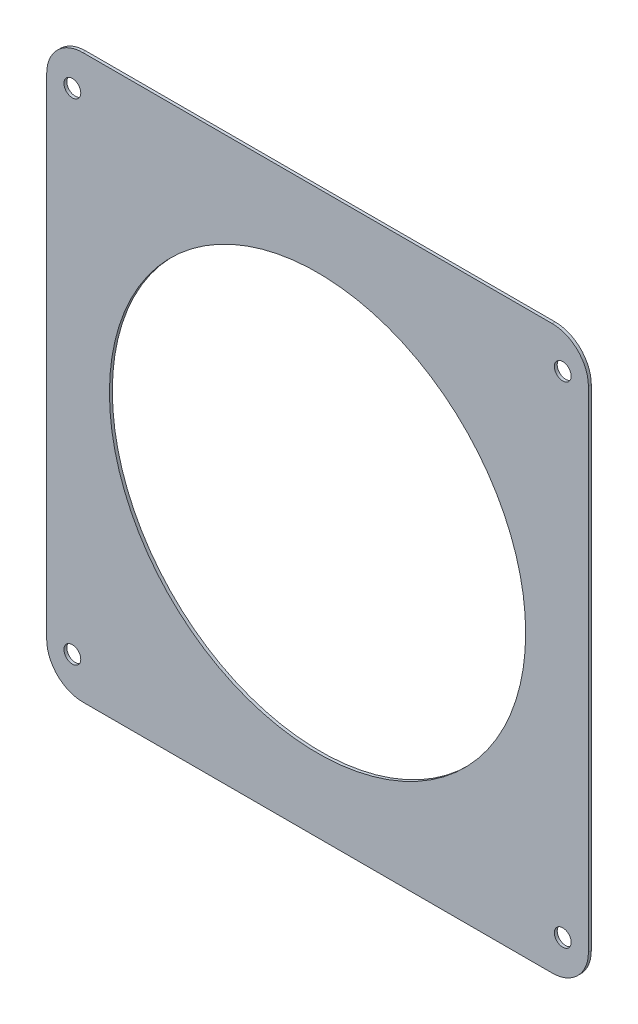
from build123d import *

# Parameters (mm, degrees)
SKETCH2_W           = 95
SKETCH2_H           = 98.65
SKETCH2_R           = 36.5
SKETCH2_R_2         = 1.475
BOSS_EXTRUDE1_DEPTH = 0.508
FILLET1_R           = 6.35


with BuildPart() as part:
    # Sketch2 → Boss-Extrude1 (new body)
    with BuildSketch(Plane.XY):
        Rectangle(SKETCH2_W, SKETCH2_H)
        Circle(SKETCH2_R, mode=Mode.SUBTRACT)
        with Locations((-43, 43)):
            Circle(SKETCH2_R_2, mode=Mode.SUBTRACT)
        with Locations((43, 43)):
            Circle(SKETCH2_R_2, mode=Mode.SUBTRACT)
        with Locations((43, -43)):
            Circle(SKETCH2_R_2, mode=Mode.SUBTRACT)
        with Locations((-43, -43)):
            Circle(SKETCH2_R_2, mode=Mode.SUBTRACT)
    extrude(amount=BOSS_EXTRUDE1_DEPTH)

    # Fillet1
    fillet1_edges = [part.edges().sort_by_distance(p)[0] for p in [
        (47.5, -49.325, 0.254),
        (-47.5, -49.325, 0.254),
        (-47.5, 49.325, 0.254),
        (47.5, 49.325, 0.254),
    ]]
    fillet(fillet1_edges, radius=FILLET1_R)


solid = part.part
